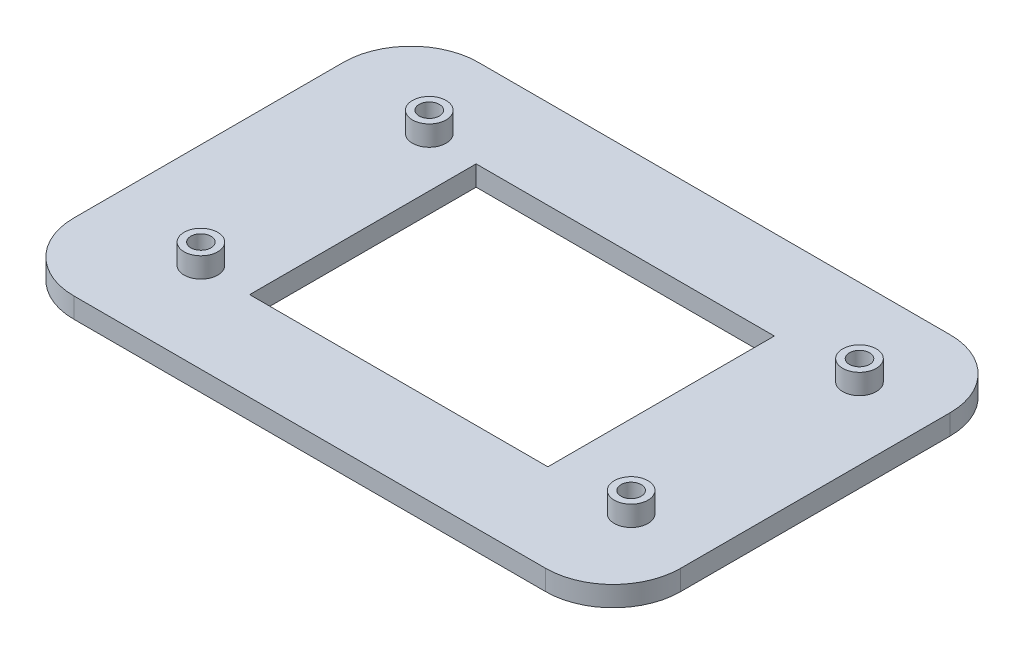
from build123d import *

# Parameters (mm, degrees)
SKETCH_1_W          = 90
SKETCH_1_H          = 60
EXTRUDE_1_DEPTH     = 3
SKETCH_2_R          = 1.5
SKETCH_2_W          = 44.23
SKETCH_2_H          = 33.59
CUT_EXTRUDE_1_DEPTH = 69.967825655
FILLET_1_R          = 10
SKETCH_3_R          = 2.5
EXTRUDE_2_DEPTH     = 3
SKETCH_4_R          = 1.5
CUT_EXTRUDE_2_DEPTH = 70.163292111


with BuildPart() as part:
    # 草圖1 → 填料-伸長1 (new body)
    with BuildSketch(Plane(origin=(0, 0, 0), x_dir=(1, 0, 0), z_dir=(0, 1, 0))):
        with Locations((-15.853658537, -2.317073171)):
            Rectangle(SKETCH_1_W, SKETCH_1_H)
    extrude(amount=EXTRUDE_1_DEPTH)

    # 草圖2 → 除料-伸長1 (cut, through all)
    with BuildSketch(Plane(origin=(0, 3, 0), x_dir=(1, 0, 0), z_dir=(0, 1, 0))):
        with Locations(Location((-45.338658537, 14.897926829, 0), (0, 0, 270))):
            Circle(SKETCH_2_R)
        with Locations(Location((-45.338658537, -18.972073171, 0), (0, 0, 270))):
            Circle(SKETCH_2_R)
        with Locations(Location((18.471341463, 14.897926829, 0), (0, 0, 270))):
            Circle(SKETCH_2_R)
        with Locations(Location((18.471341463, -18.972073171, 0), (0, 0, 270))):
            Circle(SKETCH_2_R)
        with Locations((-15.853658537, -2.317073171)):
            Rectangle(SKETCH_2_W, SKETCH_2_H)
    extrude(amount=-CUT_EXTRUDE_1_DEPTH, mode=Mode.SUBTRACT)

    # 圓角1
    fillet_1_edges = [part.edges().sort_by_distance(p)[0] for p in [
        (-60.853658537, 1.5, -27.682926829),
        (29.146341463, 1.5, -27.682926829),
        (29.146341463, 1.5, 32.317073171),
        (-60.853658537, 1.5, 32.317073171),
    ]]
    fillet(fillet_1_edges, radius=FILLET_1_R)

    # 草圖3 → 填料-伸長2 (add)
    with BuildSketch(Plane(origin=(0, 3, 0), x_dir=(1, 0, 0), z_dir=(0, 1, 0))):
        with Locations(Location((-45.338658537, 14.897926829, 0), (0, 0, 270))):
            Circle(SKETCH_3_R)
        with Locations(Location((-45.338658537, -18.972073171, 0), (0, 0, 270))):
            Circle(SKETCH_3_R)
        with Locations(Location((18.471341463, -18.972073171, 0), (0, 0, 270))):
            Circle(SKETCH_3_R)
        with Locations(Location((18.471341463, 14.897926829, 0), (0, 0, 270))):
            Circle(SKETCH_3_R)
    extrude(amount=EXTRUDE_2_DEPTH)

    # 草圖4 → 除料-伸長2 (cut, through all)
    with BuildSketch(Plane(origin=(0, 6, 0), x_dir=(1, 0, 0), z_dir=(0, 1, 0))):
        with Locations(Location((-45.338658537, 14.897926829, 0), (0, 0, 270))):
            Circle(SKETCH_4_R)
        with Locations(Location((-45.338658537, -18.972073171, 0), (0, 0, 270))):
            Circle(SKETCH_4_R)
        with Locations(Location((18.471341463, 14.897926829, 0), (0, 0, 270))):
            Circle(SKETCH_4_R)
        with Locations(Location((18.471341463, -18.972073171, 0), (0, 0, 270))):
            Circle(SKETCH_4_R)
    extrude(amount=-CUT_EXTRUDE_2_DEPTH, mode=Mode.SUBTRACT)


solid = part.part
